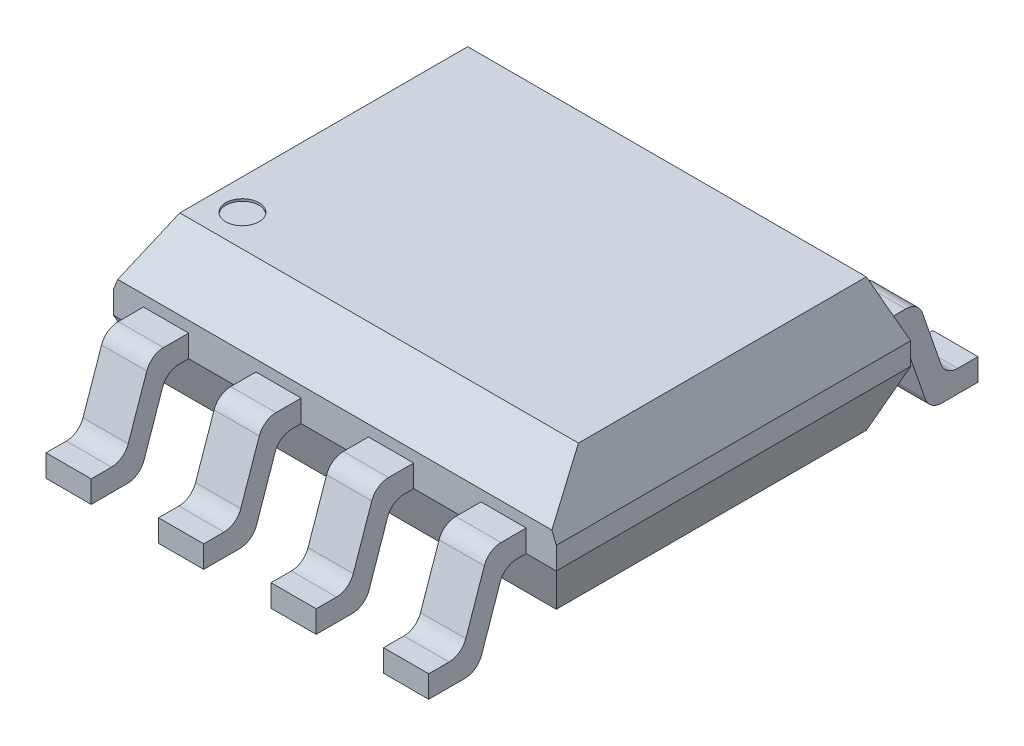
from build123d import *

# Parameters (mm, degrees)
BOSS_EXTRUDE1_START = 0.25
SKETCH1_W           = 5
SKETCH1_H           = 4
BOSS_EXTRUDE1_DEPTH = 1.5
CUT_EXTRUDE1_DEPTH  = 6.031152949
CUT_EXTRUDE2_DEPTH  = 6.662375826
SKETCH4_R           = 0.187140245
CUT_EXTRUDE3_DEPTH  = 0.0254
BOSS_EXTRUDE3_DEPTH = 5
FILLET1_R           = 0.2
SKETCH7_W           = 0.34
SKETCH7_H           = 1.1
SKETCH7_W_2         = 0.76
CUT_EXTRUDE4_DEPTH  = 5.35


with BuildPart() as part:
    # Sketch1 → Boss-Extrude1 (new body)
    with BuildSketch(Plane(origin=(0, 0, 0), x_dir=(1, 0, 0), z_dir=(0, 1, 0)).offset(BOSS_EXTRUDE1_START)):
        Rectangle(SKETCH1_W, SKETCH1_H)
    extrude(amount=BOSS_EXTRUDE1_DEPTH)

    # Sketch2 → Cut-Extrude1 (cut, through all)
    with BuildSketch(Plane.XY.offset(2)):
        Polygon((-2.5, 1.75), (-2.25, 1.75), (-2.5, 1.125), align=None)
        Polygon((-2.5, 0.875), (-2.5, 0.25), (-2.25, 0.25), align=None)
        Polygon((2.5, 0.25), (2.25, 0.25), (2.5, 0.875), align=None)
        Polygon((2.5, 1.125), (2.5, 1.75), (2.25, 1.75), align=None)
    extrude(amount=-CUT_EXTRUDE1_DEPTH, mode=Mode.SUBTRACT)

    # Sketch3 → Cut-Extrude2 (cut, through all)
    with BuildSketch(Plane.ZY.offset(2.5)):
        Polygon((1.5, 1.75), (2, 1.25), (2, 1.75), align=None)
        Polygon((2, 0.875), (1.75, 0.25), (2, 0.25), align=None)
        Polygon((-2, 0.25), (-2, 0.875), (-1.75, 0.25), align=None)
        Polygon((-2, 1.125), (-1.75, 1.75), (-2, 1.75), align=None)
    extrude(amount=-CUT_EXTRUDE2_DEPTH, mode=Mode.SUBTRACT)

    # Sketch4 → Cut-Extrude3 (cut)
    with BuildSketch(Plane(origin=(0, 1.75, 0), x_dir=(1, 0, 0), z_dir=(0, 1, 0))):
        with Locations(Location((-1.903012969, -1.14, 0), (0, 0, 270))):
            Circle(SKETCH4_R)
    extrude(amount=-CUT_EXTRUDE3_DEPTH, mode=Mode.SUBTRACT)


with BuildPart() as body_2:
    # Sketch5 → Boss-Extrude3 (new body)
    with BuildSketch(Plane(origin=(2.5, 0, 0), x_dir=(0, 0, -1), z_dir=(1, 0, 0))):
        Polygon((2, 1.125), (2.426472421, 1.125), (2.728232142, 0.25), (3.1, 0.25), (3.1, 0), (2.55, 0), (2.247997903, 0.875702809), (2, 0.875), align=None)
    extrude(amount=-BOSS_EXTRUDE3_DEPTH)

    # Fillet1
    fillet1_edges = [body_2.edges().sort_by_distance(p)[0] for p in [
        (0, 1.125, -2.426472421),
        (0, 0.25, -2.728232142),
        (0, 0, -2.55),
        (0, 0.875702809, -2.247997903),
    ]]
    fillet(fillet1_edges, radius=FILLET1_R)

    # Sketch7 → Cut-Extrude4 (cut, through all)
    with BuildSketch(Plane(origin=(0, 1.75, 0), x_dir=(1, 0, 0), z_dir=(0, 1, 0))):
        with Locations((-2.33, 2.55)):
            Rectangle(SKETCH7_W, SKETCH7_H)
        with Locations((-1.27, 2.55)):
            Rectangle(SKETCH7_W_2, SKETCH7_H)
        with Locations((0, 2.55)):
            Rectangle(SKETCH7_W_2, SKETCH7_H)
        with Locations((1.27, 2.55)):
            Rectangle(SKETCH7_W_2, SKETCH7_H)
        with Locations((2.33, 2.55)):
            Rectangle(SKETCH7_W, SKETCH7_H)
    extrude(amount=-CUT_EXTRUDE4_DEPTH, mode=Mode.SUBTRACT)


with BuildPart() as cut_extrude4_piece_1:
    # of the separate pieces the step leaves, piece 1, a body of its own (cut_extrude4_pieces)
    add(body_2.part.solids().sort_by_distance((2.16, 1.125, -2.283886708))[0])


with BuildPart() as cut_extrude4_piece_2:
    # of the separate pieces the step leaves, piece 2, a body of its own (cut_extrude4_pieces)
    add(body_2.part.solids().sort_by_distance((-0.38, 1.125, -2.283886708))[0])


with BuildPart() as cut_extrude4_piece_3:
    # of the separate pieces the step leaves, piece 3, a body of its own (cut_extrude4_pieces)
    add(body_2.part.solids().sort_by_distance((-1.65, 1.125, -2.283886708))[0])


with BuildPart() as cut_extrude4_piece_4:
    # of the separate pieces the step leaves, piece 4, a body of its own (cut_extrude4_pieces)
    add(body_2.part.solids().sort_by_distance((0.89, 1.125, -2.283886708))[0])


with BuildPart() as body_6:
    # Mirror1: mirrored copy
    add(cut_extrude4_piece_1.part.mirror(Plane.XY))


with BuildPart() as body_7:
    # Mirror1 2: mirrored copy
    add(cut_extrude4_piece_4.part.mirror(Plane.XY))


with BuildPart() as body_8:
    # Mirror1 3: mirrored copy
    add(cut_extrude4_piece_2.part.mirror(Plane.XY))


with BuildPart() as body_9:
    # Mirror1 4: mirrored copy
    add(cut_extrude4_piece_3.part.mirror(Plane.XY))


solid = Compound([part.part, cut_extrude4_piece_1.part, cut_extrude4_piece_2.part, cut_extrude4_piece_3.part, cut_extrude4_piece_4.part, body_6.part, body_7.part, body_8.part, body_9.part])
